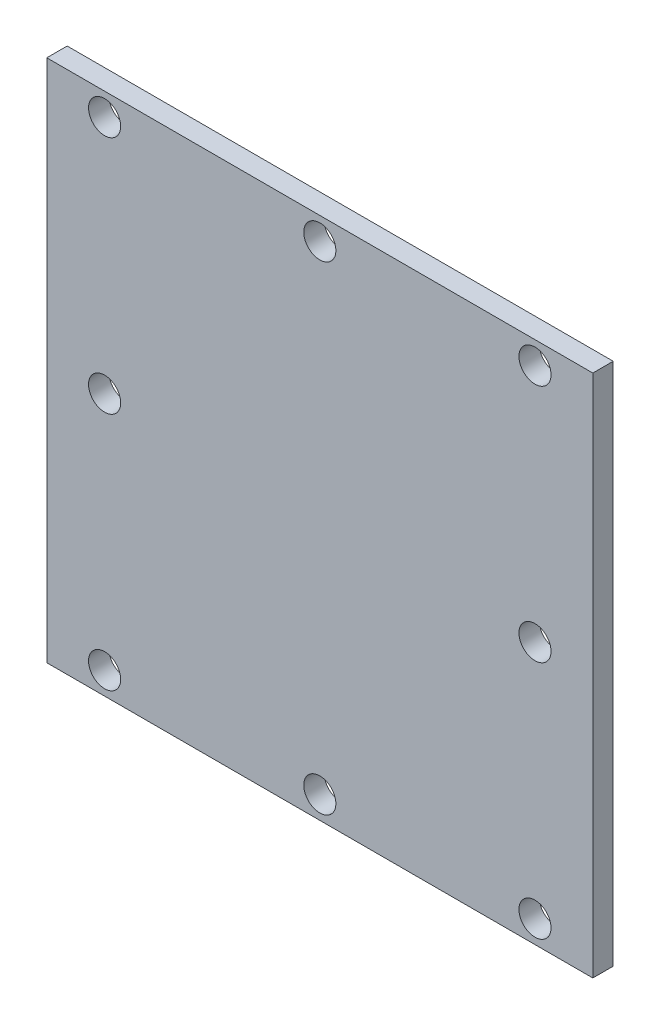
from build123d import *

# Parameters (mm, degrees)
SKETCH1_W           = 170
SKETCH1_H           = 163.12
SKETCH1_R           = 5
BOSS_EXTRUDE1_DEPTH = 6.35


with BuildPart() as part:
    # Sketch1 → Boss-Extrude1 (new body)
    with BuildSketch(Plane.XY):
        with Locations((85, 81.56)):
            Rectangle(SKETCH1_W, SKETCH1_H)
        with Locations((85, 7)):
            Circle(SKETCH1_R, mode=Mode.SUBTRACT)
        with Locations((152, 7)):
            Circle(SKETCH1_R, mode=Mode.SUBTRACT)
        with Locations((18, 7)):
            Circle(SKETCH1_R, mode=Mode.SUBTRACT)
        with Locations((18, 81.56)):
            Circle(SKETCH1_R, mode=Mode.SUBTRACT)
        with Locations((18, 156.12)):
            Circle(SKETCH1_R, mode=Mode.SUBTRACT)
        with Locations((152, 81.56)):
            Circle(SKETCH1_R, mode=Mode.SUBTRACT)
        with Locations((152, 156.12)):
            Circle(SKETCH1_R, mode=Mode.SUBTRACT)
        with Locations((85, 156.12)):
            Circle(SKETCH1_R, mode=Mode.SUBTRACT)
    extrude(amount=-BOSS_EXTRUDE1_DEPTH)


solid = part.part
